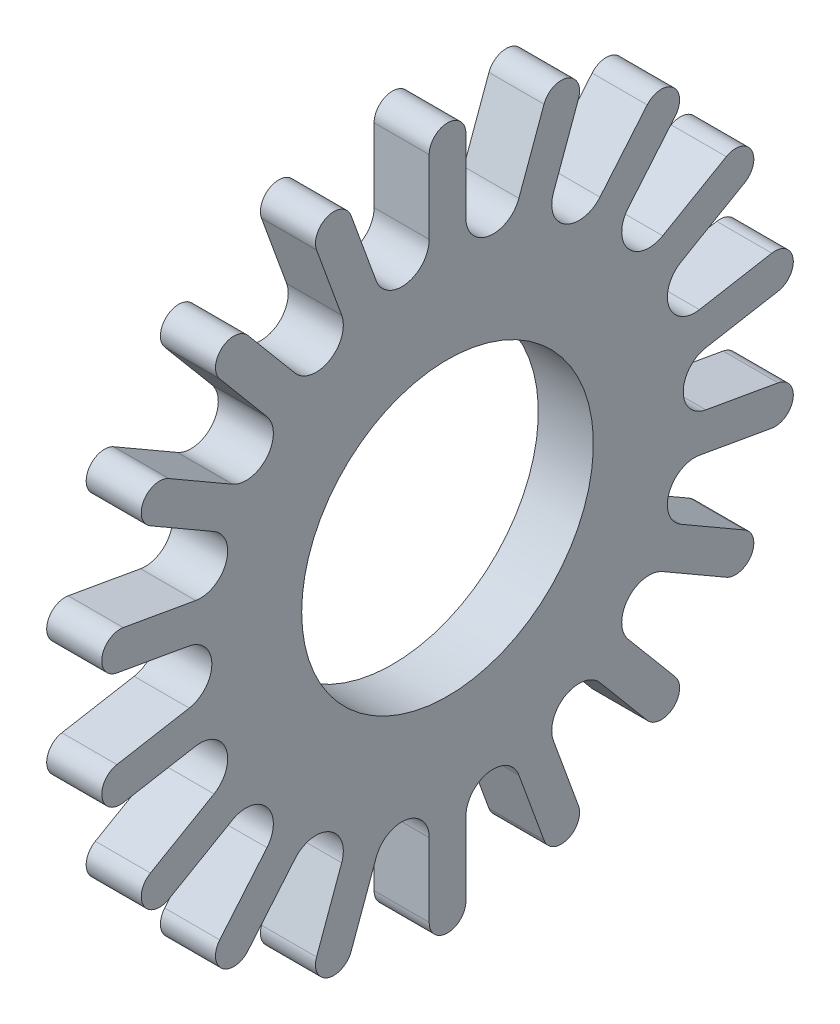
from build123d import *

# Parameters (mm, degrees)
SKETCH1_R           = 12.614459283
BOSS_EXTRUDE1_DEPTH = 4.7625


with BuildPart() as part:
    # Sketch1 → Boss-Extrude1 (new body)
    with BuildSketch(Plane(origin=(0, 0, 0), x_dir=(0, 0, -1), z_dir=(1, 0, 0))):
        with BuildLine():
            Line((6.982856305, 40.645980292), (4.811028394, 34.67893215))
            ThreePointArc((4.811028394, 34.67893215), (2.180363954, 33.160117328), (0.227813255, 35.487076638))
            Line((0.227813255, 35.487076638), (0.227813255, 41.837076638))
            ThreePointArc((0.227813255, 41.837076638), (-1.359686745, 43.424576638), (-2.947186745, 41.837076638))
            Line((-2.947186745, 41.837076638), (-2.947186745, 35.487076638))
            ThreePointArc((-2.947186745, 35.487076638), (-4.899737444, 33.160117328), (-7.530401884, 34.67893215))
            Line((-7.530401884, 34.67893215), (-9.702229795, 40.645980292))
            ThreePointArc((-9.702229795, 40.645980292), (-11.736948808, 41.59478535), (-12.685753866, 39.560066337))
            Line((-12.685753866, 39.560066337), (-10.513925955, 33.593018195))
            ThreePointArc((-10.513925955, 33.593018195), (-11.552856482, 30.738580033), (-14.544337708, 31.266058885))
            Line((-14.544337708, 31.266058885), (-18.62603903, 36.130441099))
            ThreePointArc((-18.62603903, 36.130441099), (-20.862559913, 36.326111322), (-21.058230136, 34.089590438))
            Line((-21.058230136, 34.089590438), (-16.976528815, 29.225208224))
            ThreePointArc((-16.976528815, 29.225208224), (-16.976528815, 26.187578579), (-19.968010041, 25.660099726))
            Line((-19.968010041, 25.660099726), (-25.467271355, 28.835099726))
            ThreePointArc((-25.467271355, 28.835099726), (-27.635836683, 28.254034398), (-27.054771355, 26.085469069))
            Line((-27.054771355, 26.085469069), (-21.555510041, 22.910469069))
            ThreePointArc((-21.555510041, 22.910469069), (-20.516579514, 20.056030907), (-23.147243954, 18.537216084))
            Line((-23.147243954, 18.537216084), (-29.400773186, 19.639882012))
            ThreePointArc((-29.400773186, 19.639882012), (-31.239821976, 18.352166186), (-29.95210615, 16.513117396))
            Line((-29.95210615, 16.513117396), (-23.698576918, 15.410451468))
            ThreePointArc((-23.698576918, 15.410451468), (-21.746026219, 13.083492158), (-23.698576918, 10.756532847))
            Line((-23.698576918, 10.756532847), (-29.95210615, 9.653866919))
            ThreePointArc((-29.95210615, 9.653866919), (-31.239821976, 7.814818129), (-29.400773186, 6.527102303))
            Line((-29.400773186, 6.527102303), (-23.147243954, 7.629768232))
            ThreePointArc((-23.147243954, 7.629768232), (-20.516579514, 6.110953409), (-21.555510041, 3.256515246))
            Line((-21.555510041, 3.256515246), (-27.054771355, 0.081515246))
            ThreePointArc((-27.054771355, 0.081515246), (-27.635836683, -2.087050082), (-25.467271355, -2.668115411))
            Line((-25.467271355, -2.668115411), (-19.968010041, 0.506884589))
            ThreePointArc((-19.968010041, 0.506884589), (-16.976528815, -0.020594263), (-16.976528815, -3.058223909))
            Line((-16.976528815, -3.058223909), (-21.058230136, -7.922606123))
            ThreePointArc((-21.058230136, -7.922606123), (-20.862559913, -10.159127007), (-18.62603903, -9.963456784))
            Line((-18.62603903, -9.963456784), (-14.544337708, -5.09907457))
            ThreePointArc((-14.544337708, -5.09907457), (-11.552856482, -4.571595717), (-10.513925955, -7.42603388))
            Line((-10.513925955, -7.42603388), (-12.685753866, -13.393082022))
            ThreePointArc((-12.685753866, -13.393082022), (-11.736948808, -15.427801035), (-9.702229795, -14.478995977))
            Line((-9.702229795, -14.478995977), (-7.530401884, -8.511947835))
            ThreePointArc((-7.530401884, -8.511947835), (-4.899737444, -6.993133012), (-2.947186745, -9.320092323))
            Line((-2.947186745, -9.320092323), (-2.947186745, -15.670092323))
            ThreePointArc((-2.947186745, -15.670092323), (-1.359686745, -17.257592323), (0.227813255, -15.670092323))
            Line((0.227813255, -15.670092323), (0.227813255, -9.320092323))
            ThreePointArc((0.227813255, -9.320092323), (2.180363954, -6.993133012), (4.811028394, -8.511947835))
            Line((4.811028394, -8.511947835), (6.982856305, -14.478995977))
            ThreePointArc((6.982856305, -14.478995977), (9.017575318, -15.427801035), (9.966380376, -13.393082022))
            Line((9.966380376, -13.393082022), (7.794552465, -7.42603388))
            ThreePointArc((7.794552465, -7.42603388), (8.833482992, -4.571595717), (11.824964218, -5.09907457))
            Line((11.824964218, -5.09907457), (15.90666554, -9.963456784))
            ThreePointArc((15.90666554, -9.963456784), (18.143186423, -10.159127007), (18.338856646, -7.922606123))
            Line((18.338856646, -7.922606123), (14.257155325, -3.058223909))
            ThreePointArc((14.257155325, -3.058223909), (14.257155325, -0.020594263), (17.248636551, 0.506884589))
            Line((17.248636551, 0.506884589), (22.747897865, -2.668115411))
            ThreePointArc((22.747897865, -2.668115411), (24.916463193, -2.087050082), (24.335397865, 0.081515246))
            Line((24.335397865, 0.081515246), (18.836136551, 3.256515246))
            ThreePointArc((18.836136551, 3.256515246), (17.797206024, 6.110953409), (20.427870464, 7.629768232))
            Line((20.427870464, 7.629768232), (26.681399696, 6.527102303))
            ThreePointArc((26.681399696, 6.527102303), (28.520448486, 7.814818129), (27.23273266, 9.653866919))
            Line((27.23273266, 9.653866919), (20.979203428, 10.756532847))
            ThreePointArc((20.979203428, 10.756532847), (19.026652729, 13.083492158), (20.979203428, 15.410451468))
            Line((20.979203428, 15.410451468), (27.23273266, 16.513117396))
            ThreePointArc((27.23273266, 16.513117396), (28.520448486, 18.352166186), (26.681399696, 19.639882012))
            Line((26.681399696, 19.639882012), (20.427870464, 18.537216084))
            ThreePointArc((20.427870464, 18.537216084), (17.797206024, 20.056030907), (18.836136551, 22.910469069))
            Line((18.836136551, 22.910469069), (24.335397865, 26.085469069))
            ThreePointArc((24.335397865, 26.085469069), (24.916463193, 28.254034398), (22.747897865, 28.835099726))
            Line((22.747897865, 28.835099726), (17.248636551, 25.660099726))
            ThreePointArc((17.248636551, 25.660099726), (14.257155325, 26.187578579), (14.257155325, 29.225208224))
            Line((14.257155325, 29.225208224), (18.338856646, 34.089590438))
            ThreePointArc((18.338856646, 34.089590438), (18.143186423, 36.326111322), (15.90666554, 36.130441099))
            Line((15.90666554, 36.130441099), (11.824964218, 31.266058885))
            ThreePointArc((11.824964218, 31.266058885), (8.833482992, 30.738580033), (7.794552465, 33.593018195))
            Line((7.794552465, 33.593018195), (9.966380376, 39.560066337))
            ThreePointArc((9.966380376, 39.560066337), (9.017575318, 41.59478535), (6.982856305, 40.645980292))
        make_face()
        with Locations(Location((-1.359686745, 13.083492158, 0), (0, 0, 180))):
            Circle(SKETCH1_R, mode=Mode.SUBTRACT)
    extrude(amount=BOSS_EXTRUDE1_DEPTH)


solid = part.part
